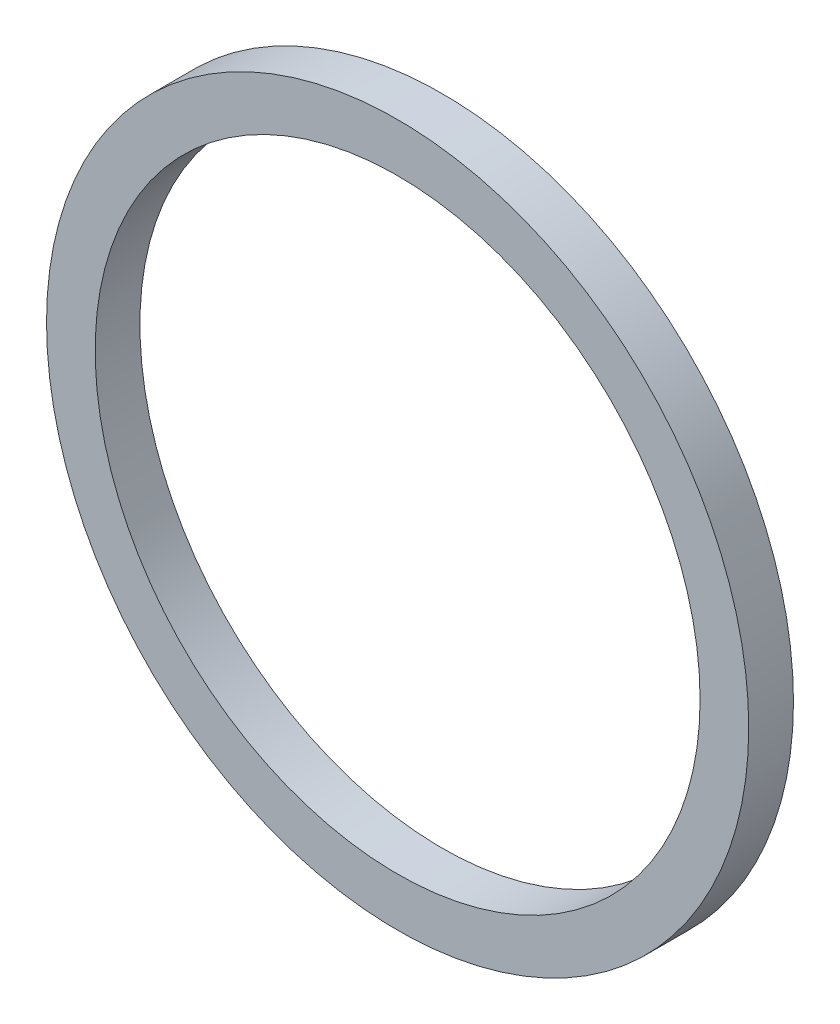
from build123d import *

# Parameters (mm, degrees)
SKETCH1_R           = 45.837475
SKETCH1_R_2         = 39.487475
BOSS_EXTRUDE1_DEPTH = 5.842


with BuildPart() as part:
    # Sketch1 → Boss-Extrude1 (new body)
    with BuildSketch(Plane.XY):
        Circle(SKETCH1_R)
        Circle(SKETCH1_R_2, mode=Mode.SUBTRACT)
    extrude(amount=BOSS_EXTRUDE1_DEPTH)


solid = part.part
